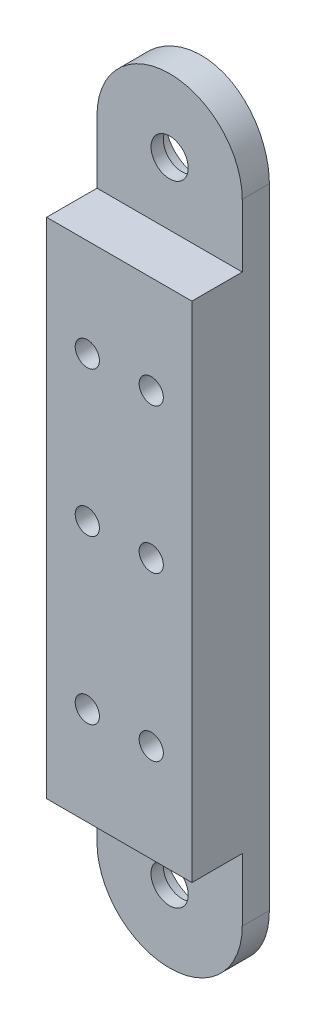
from build123d import *

# Parameters (mm, degrees)
MAIN_PROFILE_DEPTH                             = 50.8
END_ROUNDS_DEPTH                               = 25.4
SKETCH3_W                                      = 3.302
SKETCH3_H                                      = 4.7625
SKETCH3_H_2                                    = 4.1275
LOCATING_FLANGE_DEPTH                          = 53.111155755
BUTTON_POCKETS_DEPTH                           = 3.81
CBORE_FOR_2_SOCKET_HEAD_CAP_SCREW1_D           = 2.4384
CBORE_FOR_2_SOCKET_HEAD_CAP_SCREW1_CBORE_D     = 4.572
CBORE_FOR_2_SOCKET_HEAD_CAP_SCREW1_CBORE_DEPTH = 1.27
F_1_16_0_0625_DIAMETER_HOLE1_D                 = 1.5875


with BuildPart() as part:
    # Sketch1 → Main profile (new body)
    with BuildSketch(Plane(origin=(0, 0, 0), x_dir=(1, 0, 0), z_dir=(0, 1, 0))):
        with BuildLine():
            Line((-4.191328185, 1.27), (5.333671815, 1.27))
            Line((5.333671815, 1.27), (5.333671815, 6.35))
            ThreePointArc((5.333671815, 6.35), (0.571171815, 6.648828143), (-4.191328185, 6.35))
            Line((-4.191328185, 6.35), (-4.191328185, 1.27))
        make_face()
    extrude(amount=MAIN_PROFILE_DEPTH)

    # Sketch2 → End rounds (cut)
    with BuildSketch(Plane.XY.offset(-1.27)):
        with BuildLine():
            Line((-4.191328185, 50.8), (-4.191328185, 46.0375))
            ThreePointArc((-4.191328185, 46.0375), (-2.796424231, 49.405096045), (0.571171815, 50.8))
            Line((0.571171815, 50.8), (-4.191328185, 50.8))
        make_face()
        with BuildLine():
            Line((5.333671815, 50.8), (0.571171815, 50.8))
            ThreePointArc((0.571171815, 50.8), (3.93876786, 49.405096045), (5.333671815, 46.0375))
            Line((5.333671815, 46.0375), (5.333671815, 50.8))
        make_face()
        with BuildLine():
            ThreePointArc((5.333671815, 4.7625), (3.938767861, 1.394903955), (0.571171817, 0))
            Line((0.571171817, 0), (5.333671815, 0))
            Line((5.333671815, 0), (5.333671815, 4.7625))
        make_face()
        with BuildLine():
            ThreePointArc((0.571171817, 0), (-2.79642423, 1.394903954), (-4.191328185, 4.7625))
            Line((-4.191328185, 4.7625), (-4.191328185, 0))
            Line((-4.191328185, 0), (0.571171817, 0))
        make_face()
    extrude(amount=-END_ROUNDS_DEPTH, mode=Mode.SUBTRACT)

    # Sketch3 → Locating Flange (cut, through all)
    with BuildSketch(Plane.ZY.offset(4.191328185)):
        with Locations((-2.921, 2.38125)):
            Rectangle(SKETCH3_W, SKETCH3_H)
        with Locations((-2.921, 6.82625)):
            Rectangle(SKETCH3_W, SKETCH3_H_2)
        with Locations((-2.921, 43.97375)):
            Rectangle(SKETCH3_W, SKETCH3_H_2)
        with Locations((-2.921, 48.41875)):
            Rectangle(SKETCH3_W, SKETCH3_H)
    extrude(amount=-LOCATING_FLANGE_DEPTH, mode=Mode.SUBTRACT)

    # Sketch4 → Button Pockets (cut)
    with BuildSketch(Plane(origin=(0, 0, -6.648828143), x_dir=(-1, 0, 0), z_dir=(0, 0, -1))):
        with BuildLine():
            Line((-2.682671815, 38.735), (1.540328185, 38.735))
            ThreePointArc((1.540328185, 38.735), (2.337237528, 38.404909342), (2.667328185, 37.608))
            Line((2.667328185, 37.608), (2.667328185, 33.385))
            ThreePointArc((2.667328185, 33.385), (2.337237528, 32.588090658), (1.540328185, 32.258))
            Line((1.540328185, 32.258), (-2.682671815, 32.258))
            ThreePointArc((-2.682671815, 32.258), (-3.479581157, 32.588090658), (-3.809671815, 33.385))
            Line((-3.809671815, 33.385), (-3.809671815, 37.608))
            ThreePointArc((-3.809671815, 37.608), (-3.479581157, 38.404909342), (-2.682671815, 38.735))
        make_face()
        with BuildLine():
            Line((-2.682671815, 29.226), (1.540328185, 29.226))
            ThreePointArc((1.540328185, 29.226), (2.337237528, 28.895909342), (2.667328185, 28.099))
            Line((2.667328185, 28.099), (2.667328185, 23.876))
            ThreePointArc((2.667328185, 23.876), (2.337237528, 23.079090658), (1.540328185, 22.749))
            Line((1.540328185, 22.749), (-2.682671815, 22.749))
            ThreePointArc((-2.682671815, 22.749), (-3.479581157, 23.079090658), (-3.809671815, 23.876))
            Line((-3.809671815, 23.876), (-3.809671815, 28.099))
            ThreePointArc((-3.809671815, 28.099), (-3.479581157, 28.895909342), (-2.682671815, 29.226))
        make_face()
        with BuildLine():
            Line((-2.682671815, 18.542), (1.540328185, 18.542))
            ThreePointArc((1.540328185, 18.542), (2.337237528, 18.211909342), (2.667328185, 17.415))
            Line((2.667328185, 17.415), (2.667328185, 13.192))
            ThreePointArc((2.667328185, 13.192), (2.337237528, 12.395090658), (1.540328185, 12.065))
            Line((1.540328185, 12.065), (-2.682671815, 12.065))
            ThreePointArc((-2.682671815, 12.065), (-3.479581157, 12.395090658), (-3.809671815, 13.192))
            Line((-3.809671815, 13.192), (-3.809671815, 17.415))
            ThreePointArc((-3.809671815, 17.415), (-3.479581157, 18.211909342), (-2.682671815, 18.542))
        make_face()
    extrude(amount=-BUTTON_POCKETS_DEPTH, mode=Mode.SUBTRACT)

    # CBORE for #2 Socket Head Cap Screw1 (through all)
    with Locations(Plane(origin=(0, 0, -6.648828143), x_dir=(-1, 0, 0), z_dir=(0, 0, -1))):
        with Locations((-0.571171815, 46.0375), (-0.571171815, 4.7625)):
            CounterBoreHole(CBORE_FOR_2_SOCKET_HEAD_CAP_SCREW1_D / 2, CBORE_FOR_2_SOCKET_HEAD_CAP_SCREW1_CBORE_D / 2, CBORE_FOR_2_SOCKET_HEAD_CAP_SCREW1_CBORE_DEPTH)

    # 1/16 (0.0625) Diameter Hole1 (through all)
    with Locations(Plane.XY.offset(-1.27)):
        with Locations((-1.524328185, 35.4965), (2.666671815, 35.4965), (2.666671815, 25.9875), (-1.524328185, 25.9875), (-1.524328185, 15.3035), (2.666671815, 15.3035)):
            Hole(F_1_16_0_0625_DIAMETER_HOLE1_D / 2)


solid = part.part
